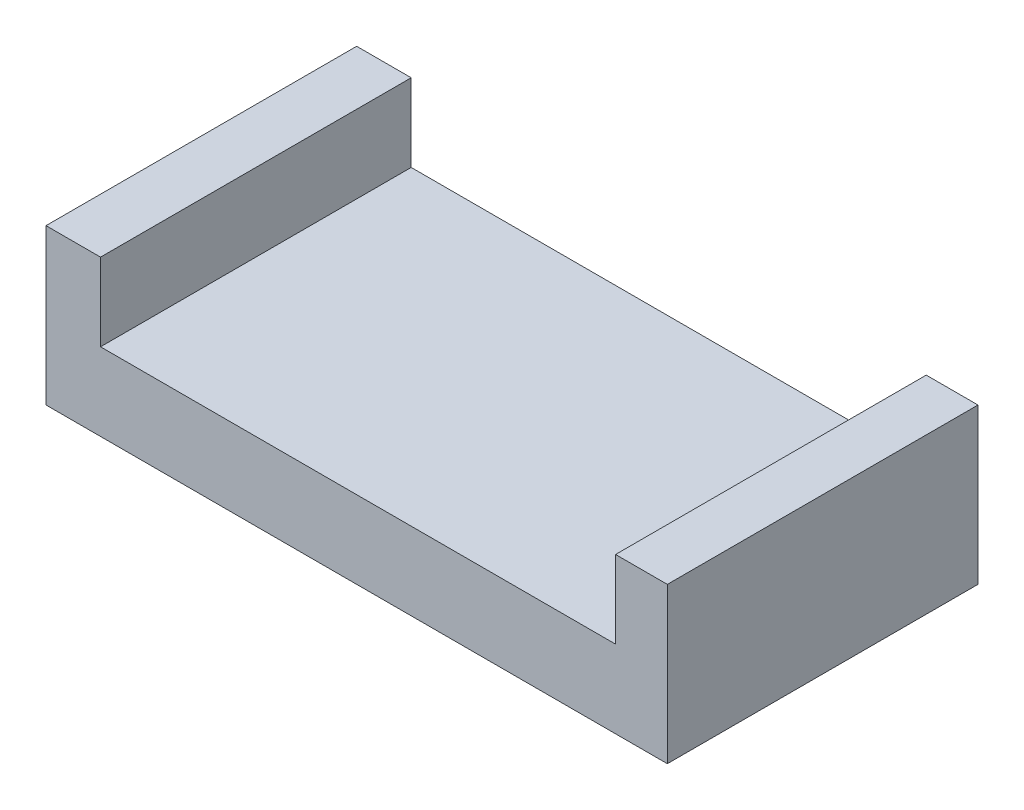
from build123d import *

# Parameters (mm, degrees)
SKETCH1_W           = 15.24
SKETCH1_H           = 7.62
BOSS_EXTRUDE1_DEPTH = 1.905
SKETCH2_W           = 1.337581399
SKETCH2_H           = 7.62
BOSS_EXTRUDE2_DEPTH = 1.905
SKETCH3_W           = 1.27
SKETCH3_H           = 7.62
BOSS_EXTRUDE3_DEPTH = 1.905


with BuildPart() as part:
    # Sketch1 → Boss-Extrude1 (new body)
    with BuildSketch(Plane(origin=(0, 0, 0), x_dir=(1, 0, 0), z_dir=(0, 1, 0))):
        Rectangle(SKETCH1_W, SKETCH1_H)
    extrude(amount=BOSS_EXTRUDE1_DEPTH)

    # Sketch2 → Boss-Extrude2 (add)
    with BuildSketch(Plane(origin=(0, 1.905, 0), x_dir=(1, 0, 0), z_dir=(0, 1, 0))):
        with Locations((-6.951209301, 0)):
            Rectangle(SKETCH2_W, SKETCH2_H)
    extrude(amount=BOSS_EXTRUDE2_DEPTH)

    # Sketch3 → Boss-Extrude3 (add)
    with BuildSketch(Plane(origin=(0, 1.905, 0), x_dir=(1, 0, 0), z_dir=(0, 1, 0))):
        with Locations((6.985, 0)):
            Rectangle(SKETCH3_W, SKETCH3_H)
    extrude(amount=BOSS_EXTRUDE3_DEPTH)


solid = part.part
